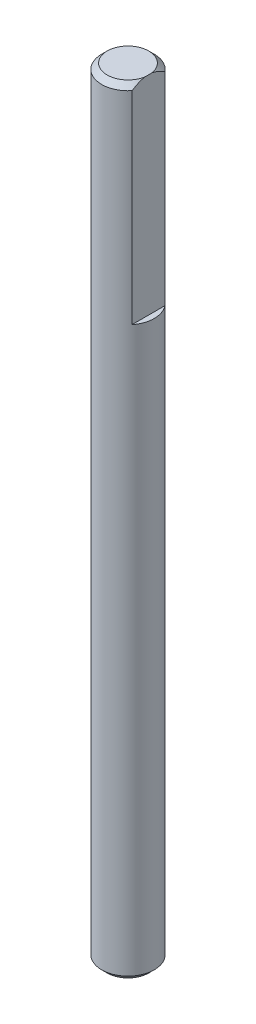
from build123d import *

# Parameters (mm, degrees)
SKETCH1_R           = 2.4
BOSS_EXTRUDE1_DEPTH = 71
CUT_EXTRUDE1_START  = -19
CUT_EXTRUDE1_DEPTH  = 19
CHAMFER1_SIZE       = 0.5


with BuildPart() as part:
    # Sketch1 → Boss-Extrude1 (new body)
    with BuildSketch(Plane(origin=(0, 0, 0), x_dir=(1, 0, 0), z_dir=(0, 1, 0))):
        Circle(SKETCH1_R)
    extrude(amount=BOSS_EXTRUDE1_DEPTH)

    # Sketch2 → Cut-Extrude1 (cut)
    with BuildSketch(Plane(origin=(0, 71, 0), x_dir=(1, 0, 0), z_dir=(0, 1, 0)).offset(CUT_EXTRUDE1_START)):
        with BuildLine():
            Line((1.8734994, 1.5), (1.8734994, -1.5))
            ThreePointArc((1.8734994, -1.5), (2.4, 0), (1.8734994, 1.5))
        make_face()
    extrude(amount=CUT_EXTRUDE1_DEPTH, mode=Mode.SUBTRACT)

    # Chamfer1
    chamfer1_edges = [part.edges().sort_by_distance(p)[0] for p in [
        (-2.4, 0, 0),
        (-2.4, 71, 0),
    ]]
    chamfer(chamfer1_edges, length=CHAMFER1_SIZE)


solid = part.part
